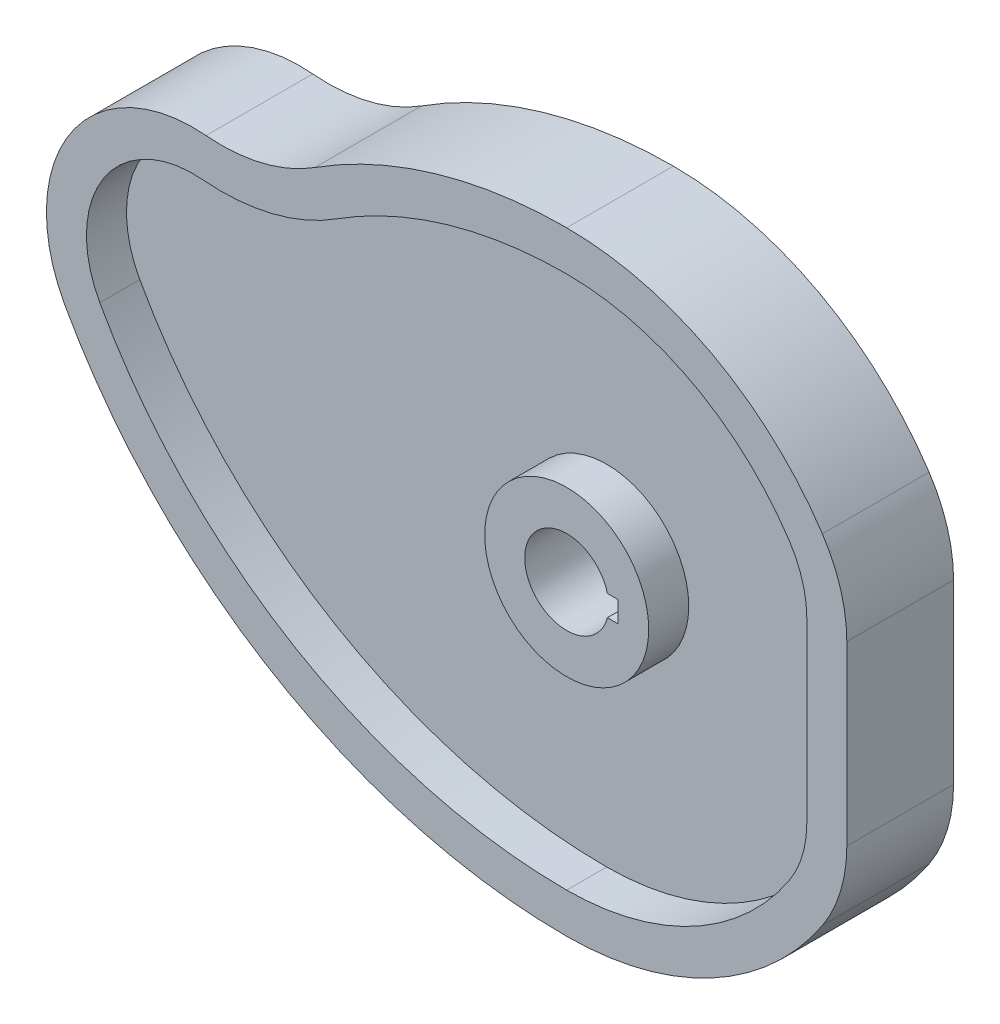
from build123d import *

# Parameters (mm, degrees)
BOSS_EXTRUDE1_DEPTH   = 25.4
SKETCH1_R             = 39.05
BOSS_EXTRUDE1_2_DEPTH = 25.4
SKETCH1_3_R           = 39.05
BOSS_EXTRUDE2_DEPTH   = 6.35


with BuildPart() as part:
    # Sketch1 → Boss-Extrude1 (new, symmetric)
    with BuildSketch(Plane.XY):
        with BuildLine():
            Line((133.35, -42.12), (133.35, 42.12))
            ThreePointArc((133.35, 42.12), (130.375973078, 62.28554269), (121.707130955, 80.733987729))
            ThreePointArc((121.707130955, 80.733987729), (69.063027707, 128.689163118), (0, 146.05))
            ThreePointArc((0, 146.05), (-62.467080094, 137.090708669), (-119.897842805, 110.935164495))
            ThreePointArc((-119.897842805, 110.935164495), (-144.729719838, 100.277998184), (-171.672691668, 98.210734349))
            ThreePointArc((-171.672691668, 98.210734349), (-236.354801658, 66.713562108), (-238.919816081, -5.184058944))
            ThreePointArc((-238.919816081, -5.184058944), (-138.677586388, -108.211737191), (0, -146.05))
            ThreePointArc((0, -146.05), (69.063027707, -128.689163118), (121.707130955, -80.733987729))
            ThreePointArc((121.707130955, -80.733987729), (130.375973078, -62.28554269), (133.35, -42.12))
        make_face()
        with BuildLine():
            ThreePointArc((105.832287787, 70.20346759), (112.137027627, 56.786145557), (114.3, 42.12))
            Line((114.3, 42.12), (114.3, -42.12))
            ThreePointArc((114.3, -42.12), (112.137027627, -56.786145557), (105.832287787, -70.20346759))
            ThreePointArc((105.832287787, -70.20346759), (60.054806702, -111.903620102), (0, -127))
            ThreePointArc((0, -127), (-129.002280352, -91.801650259), (-222.250775331, 4.037957131))
            ThreePointArc((-222.250775331, 4.037957131), (-220.385310297, 56.327136078), (-173.343775759, 79.234170436))
            ThreePointArc((-173.343775759, 79.234170436), (-140.183195045, 81.778495155), (-109.62088485, 94.895007539))
            ThreePointArc((-109.62088485, 94.895007539), (-57.112758943, 118.808647926), (0, 127))
            ThreePointArc((0, 127), (60.054806702, 111.903620102), (105.832287787, 70.20346759))
        make_face(mode=Mode.SUBTRACT)
    extrude(amount=BOSS_EXTRUDE1_DEPTH, both=True)



with BuildPart() as body_2:
    # Sketch1 → Boss-Extrude1 2 (new, symmetric)
    with BuildSketch(Plane.XY):
        Circle(SKETCH1_R)
        with BuildLine():
            ThreePointArc((19.364916731, -5), (-20, 0), (19.364916731, 5))
            Line((19.364916731, 5), (24.364916731, 5))
            Line((24.364916731, 5), (24.364916731, -5))
            Line((24.364916731, -5), (19.364916731, -5))
        make_face(mode=Mode.SUBTRACT)
    extrude(amount=BOSS_EXTRUDE1_2_DEPTH, both=True)


with BuildPart() as part_1:
    add(part.part)

    add(body_2.part)  # Boss-Extrude2 merges body 2
    # Sketch1<3> → Boss-Extrude2 (add, symmetric)
    with BuildSketch(Plane.XY):
        with BuildLine():
            Line((114.3, -42.12), (114.3, 42.12))
            ThreePointArc((114.3, 42.12), (112.137027627, 56.786145557), (105.832287787, 70.20346759))
            ThreePointArc((105.832287787, 70.20346759), (60.054806702, 111.903620102), (0, 127))
            ThreePointArc((0, 127), (-57.112758943, 118.808647926), (-109.62088485, 94.895007539))
            ThreePointArc((-109.62088485, 94.895007539), (-140.183195045, 81.778495155), (-173.343775759, 79.234170436))
            ThreePointArc((-173.343775759, 79.234170436), (-220.385310297, 56.327136078), (-222.250775331, 4.037957131))
            ThreePointArc((-222.250775331, 4.037957131), (-129.002280352, -91.801650259), (0, -127))
            ThreePointArc((0, -127), (60.054806702, -111.903620102), (105.832287787, -70.20346759))
            ThreePointArc((105.832287787, -70.20346759), (112.137027627, -56.786145557), (114.3, -42.12))
        make_face()
        Circle(SKETCH1_3_R, mode=Mode.SUBTRACT)
    extrude(amount=BOSS_EXTRUDE2_DEPTH, both=True)


solid = part_1.part
